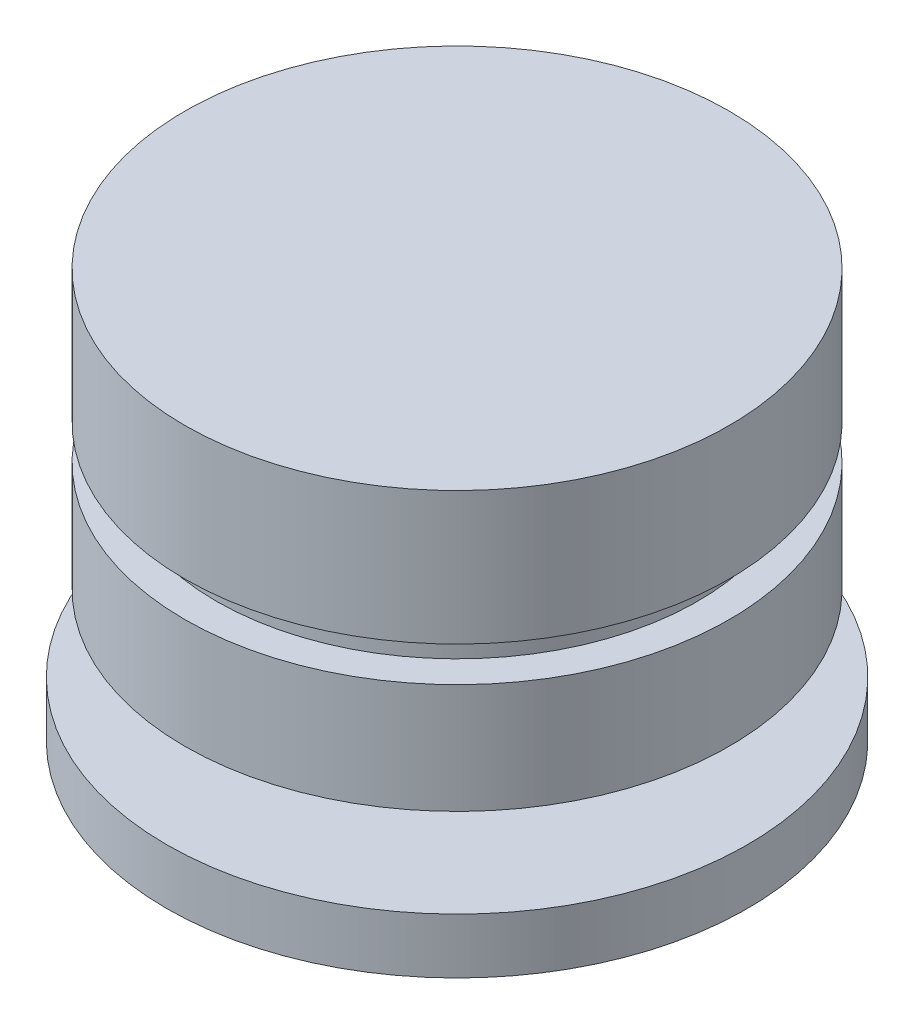
from build123d import *

# Parameters (mm, degrees)
MOUNTING_PLATE_SKETCH_R = 52.500000029
MOUNT_PLATE_DEPTH       = 10
SKETCH7_R               = 25.4
BOSS_EXTRUDE5_DEPTH     = 13.74902
SKETCH12_R              = 49.2125
BOSS_EXTRUDE6_DEPTH     = 50.23104
SKETCH15_W              = 5.715
SKETCH15_H              = 6.35


with BuildPart() as part:
    # Mounting Plate SKETCH → Mount Plate (new body)
    with BuildSketch(Plane(origin=(0, 0, 0), x_dir=(1, 0, 0), z_dir=(0, 1, 0))):
        with Locations(Location((0, 0, 0), (0, 0, 270))):
            Circle(MOUNTING_PLATE_SKETCH_R)
    extrude(amount=MOUNT_PLATE_DEPTH)

    # Sketch7 → Boss-Extrude5 (add)
    with BuildSketch(Plane(origin=(0, 10, 0), x_dir=(1, 0, 0), z_dir=(0, 1, 0))):
        with Locations(Location((0, 0, 0), (0, 0, 270))):
            Circle(SKETCH7_R)
    extrude(amount=BOSS_EXTRUDE5_DEPTH)

    # Sketch12 → Boss-Extrude6 (add)
    with BuildSketch(Plane(origin=(0, 23.74902, 0), x_dir=(1, 0, 0), z_dir=(0, 1, 0))):
        with Locations(Location((0, 0, 0), (0, 0, 270))):
            Circle(SKETCH12_R)
    extrude(amount=BOSS_EXTRUDE6_DEPTH)

    # Sketch15 → Cut-Revolve3 (revolve, cut)
    with BuildSketch(Plane(origin=(0, 0, 0), x_dir=(0, 0, -1), z_dir=(1, 0, 0)), mode=Mode.PRIVATE) as cut_revolve3_sk:
        with Locations((46.355, 46.76904)):
            Rectangle(SKETCH15_W, SKETCH15_H)
    revolve(cut_revolve3_sk.sketch.rotate(Axis((0, 0, 0), (0, -1, 0)), 180), axis=Axis((0, 0, 0), (0, -1, 0)), mode=Mode.SUBTRACT)


solid = part.part
